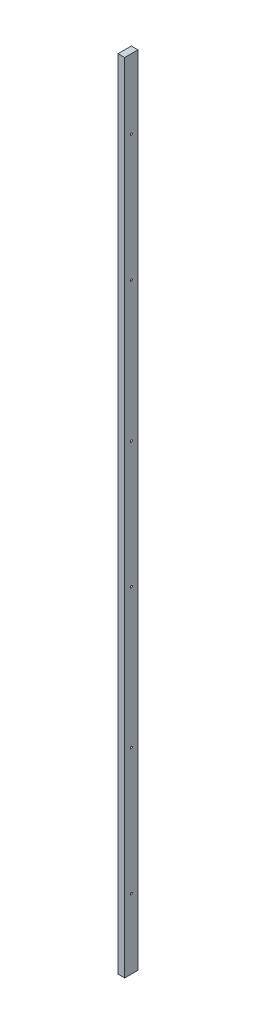
from build123d import *

# Parameters (mm, degrees)
SKETCH_1_W          = 25
SKETCH_1_H          = 50
EXTRUDE_1_DEPTH     = 3000
SKETCH_2_R          = 4
CUT_EXTRUDE_1_DEPTH = 3000
SKETCH_3_R          = 4
CUT_EXTRUDE_2_DEPTH = 3000
SKETCH_4_R          = 4
CUT_EXTRUDE_3_DEPTH = 3000


with BuildPart() as part:
    # Эскиз1 → Бобышка-Вытянуть1 (new body)
    with BuildSketch(Plane(origin=(0, 0, 0), x_dir=(1, 0, 0), z_dir=(0, 1, 0))):
        Rectangle(SKETCH_1_W, SKETCH_1_H)
    extrude(amount=EXTRUDE_1_DEPTH)

    # Эскиз2 → Вырез-Вытянуть1 (cut)
    with BuildSketch(Plane(origin=(12.5, 0, 0), x_dir=(0, 0, -1), z_dir=(1, 0, 0))):
        with Locations((0, 2737.5)):
            Circle(SKETCH_2_R)
        with Locations((0, 262.5)):
            Circle(SKETCH_2_R)
        with Locations((0, 737.5)):
            Circle(SKETCH_2_R)
    extrude(amount=-CUT_EXTRUDE_1_DEPTH, mode=Mode.SUBTRACT)

    # Эскиз3 → Вырез-Вытянуть2 (cut)
    with BuildSketch(Plane.ZY.offset(12.5)):
        with Locations((0, 2262.5)):
            Circle(SKETCH_3_R)
    extrude(amount=-CUT_EXTRUDE_2_DEPTH, mode=Mode.SUBTRACT)

    # Эскиз4 → Вырез-Вытянуть3 (cut)
    with BuildSketch(Plane.ZY.offset(12.5)):
        with Locations((0, 1737.5)):
            Circle(SKETCH_4_R)
        with Locations((0, 1262.5)):
            Circle(SKETCH_4_R)
    extrude(amount=-CUT_EXTRUDE_3_DEPTH, mode=Mode.SUBTRACT)


solid = part.part
